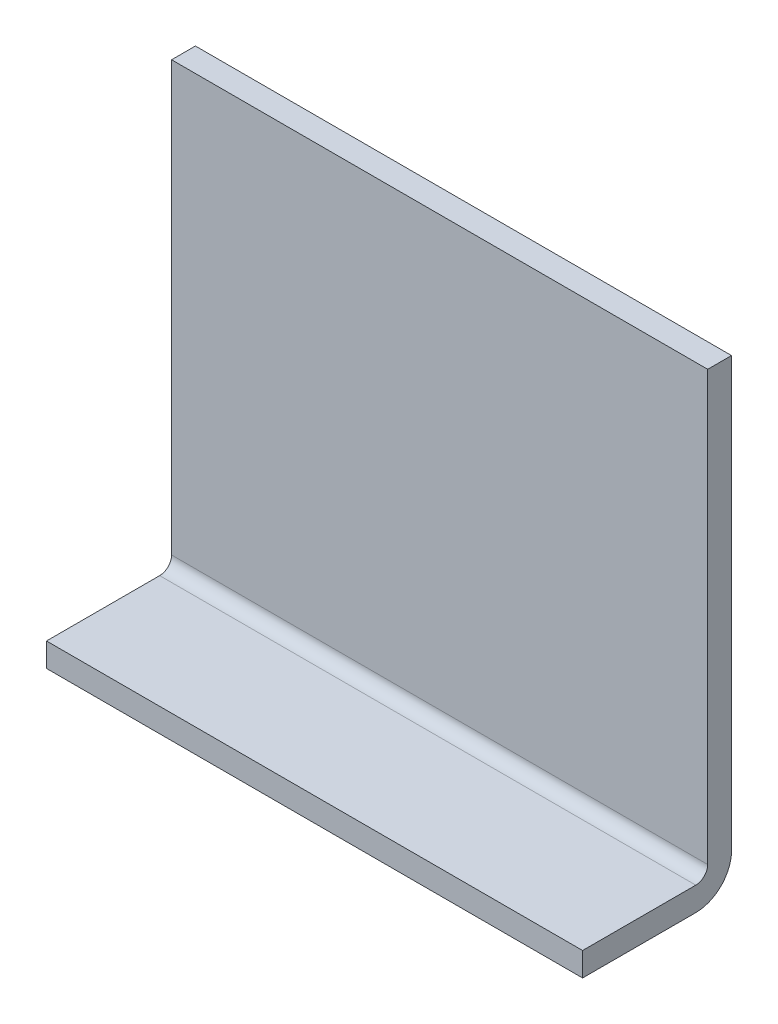
from build123d import *

# Parameters (mm, degrees)
SKETCH1_W           = 45
SKETCH1_H           = 12.5
BOSS_EXTRUDE1_DEPTH = 2
SKETCH2_W           = 45
SKETCH2_H           = 37
BOSS_EXTRUDE2_DEPTH = 2
FILLET1_R           = 1
FILLET2_R           = 3


with BuildPart() as part:
    # Sketch1 → Boss-Extrude1 (new body)
    with BuildSketch(Plane(origin=(0, 0, 0), x_dir=(1, 0, 0), z_dir=(0, 1, 0))):
        with Locations((22.5, 6.25)):
            Rectangle(SKETCH1_W, SKETCH1_H)
    extrude(amount=BOSS_EXTRUDE1_DEPTH)

    # Sketch2 → Boss-Extrude2 (add)
    with BuildSketch(Plane(origin=(0, 0, -12.5), x_dir=(-1, 0, 0), z_dir=(0, 0, -1))):
        with Locations((-22.5, 20.5)):
            Rectangle(SKETCH2_W, SKETCH2_H)
    extrude(amount=-BOSS_EXTRUDE2_DEPTH)

    # Fillet1
    fillet1_edges = [part.edges().sort_by_distance(p)[0] for p in [
        (22.5, 2, -10.5),
    ]]
    fillet(fillet1_edges, radius=FILLET1_R)

    # Fillet2
    fillet2_edges = [part.edges().sort_by_distance(p)[0] for p in [
        (22.5, 0, -12.5),
    ]]
    fillet(fillet2_edges, radius=FILLET2_R)


solid = part.part
